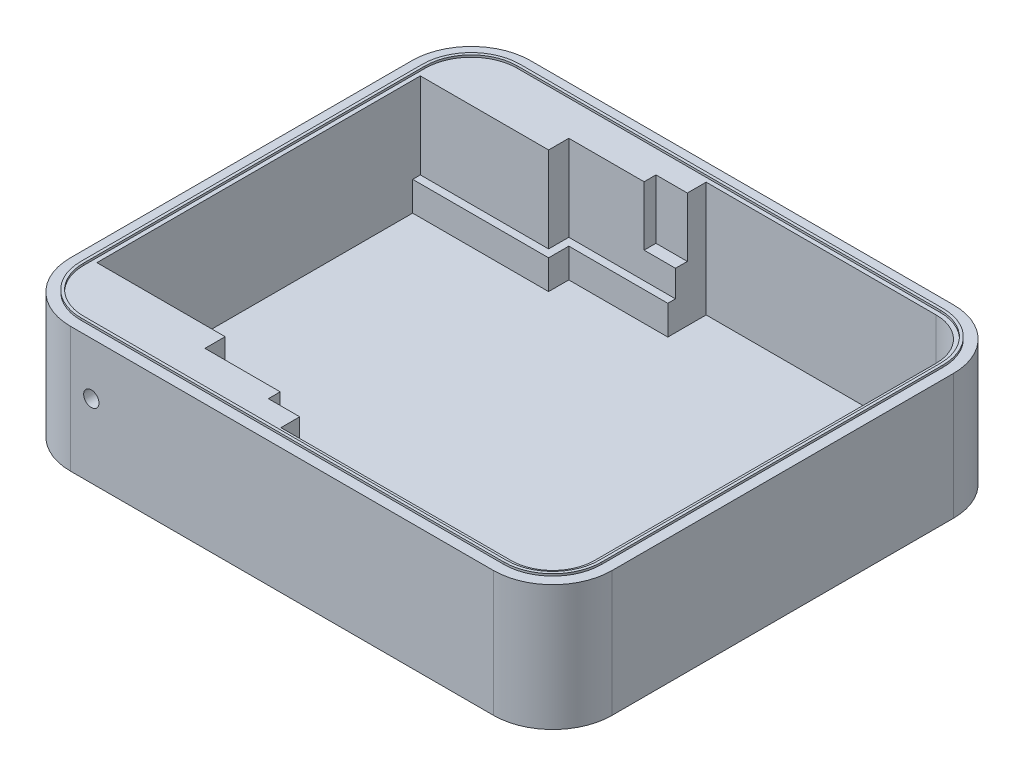
from build123d import *

# Parameters (mm, degrees)
SKETCH1_W            = 72.7
SKETCH1_H            = 61
BOSS_EXTRUDE1_DEPTH  = 1.5
SKETCH3_W            = 76.7
SKETCH3_H            = 65
BOSS_EXTRUDE5_DEPTH  = 1.5
SKETCH2_W            = 76.7
SKETCH2_H            = 65
BOSS_EXTRUDE6_DEPTH  = 4.2
SKETCH4_W            = 76.7
SKETCH4_H            = 65
BOSS_EXTRUDE7_DEPTH  = 3.8
SKETCH5_W            = 76.7
SKETCH5_H            = 65
BOSS_EXTRUDE8_DEPTH  = 8.5
SKETCH7_R            = 1.1
CUT_EXTRUDE1_DEPTH   = 20.8
FILLET3_R            = 8
SKETCH9_W            = 1.2
SKETCH9_H            = 4
CUT_EXTRUDE2_DEPTH   = 8
BOSS_EXTRUDE11_DEPTH = 4.2
FILLET4_R            = 6
FILLET2_R            = 8
BOSS_EXTRUDE12_DEPTH = 18
BOSS_EXTRUDE13_DEPTH = 0.3
SKETCH14_R           = 1.1
CUT_EXTRUDE3_DEPTH   = 14


with BuildPart() as part:
    # Sketch1 → Boss-Extrude1 (new body)
    with BuildSketch(Plane(origin=(0, 0, 0), x_dir=(1, 0, 0), z_dir=(0, 1, 0))):
        Rectangle(SKETCH1_W, SKETCH1_H)
    extrude(amount=BOSS_EXTRUDE1_DEPTH)

    # Sketch3 → Boss-Extrude5 (add)
    with BuildSketch(Plane.XZ):
        Rectangle(SKETCH3_W, SKETCH3_H)
    extrude(amount=-BOSS_EXTRUDE5_DEPTH)

    # Sketch2 → Boss-Extrude6 (add)
    with BuildSketch(Plane(origin=(0, 1.5, 0), x_dir=(1, 0, 0), z_dir=(0, 1, 0))):
        Rectangle(SKETCH2_W, SKETCH2_H)
        Polygon((-2.65, 30.5), (-2.65, 26.1), (-2.65, 22.1), (-3.85, 22.1), (-3.85, 26.1), (-17.95, 26.1), (-17.95, 22.1), (-36.35, 22.1), (-36.35, -22.1), (-17.95, -22.1), (-17.95, -26.1), (-3.85, -26.1), (-3.85, -22.1), (-2.65, -22.1), (-2.65, -26.1), (-2.65, -30.5), (36.35, -30.5), (36.35, 30.5), align=None, mode=Mode.SUBTRACT)
    extrude(amount=BOSS_EXTRUDE6_DEPTH)

    # Sketch4 → Boss-Extrude7 (add)
    with BuildSketch(Plane(origin=(0, 5.7, 0), x_dir=(1, 0, 0), z_dir=(0, 1, 0))):
        Rectangle(SKETCH4_W, SKETCH4_H)
        Polygon((-36.35, -22.1), (-36.35, -23.2), (-17.95, -23.2), (-17.95, -26.1), (-3.85, -26.1), (-3.85, -22.1), (-2.65, -22.1), (-2.65, -30.5), (36.35, -30.5), (36.35, 30.5), (-2.65, 30.5), (-2.65, 22.1), (-3.85, 22.1), (-3.85, 26.1), (-17.95, 26.1), (-17.95, 23.2), (-36.35, 23.2), (-36.35, 22.1), align=None, mode=Mode.SUBTRACT)
    extrude(amount=BOSS_EXTRUDE7_DEPTH)

    # Sketch5 → Boss-Extrude8 (add)
    with BuildSketch(Plane(origin=(0, 9.5, 0), x_dir=(1, 0, 0), z_dir=(0, 1, 0))):
        Rectangle(SKETCH5_W, SKETCH5_H)
        Polygon((-2.65, -27.8), (-3.85, -27.8), (-7.15, -27.8), (-7.15, -26.1), (-17.95, -26.1), (-17.95, -23.2), (-36.35, -23.2), (-36.35, 23.2), (-17.95, 23.2), (-17.95, 26.1), (-7.15, 26.1), (-7.15, 27.8), (-3.85, 27.8), (-2.65, 27.8), (-2.65, 30.5), (36.35, 30.5), (36.35, -30.5), (-2.65, -30.5), align=None, mode=Mode.SUBTRACT)
    extrude(amount=BOSS_EXTRUDE8_DEPTH)

    # Sketch7 → Cut-Extrude1 (cut)
    with BuildSketch(Plane(origin=(0, 0, 23.2), x_dir=(-1, 0, 0), z_dir=(0, 0, -1))):
        with Locations((27.35, 10.5)):
            Circle(SKETCH7_R)
    extrude(amount=-CUT_EXTRUDE1_DEPTH, mode=Mode.SUBTRACT)

    # Fillet3
    fillet3_edges = [part.edges().sort_by_distance(p)[0] for p in [
        (-38.35, 9, -32.5),
        (-38.35, 9, 32.5),
    ]]
    fillet(fillet3_edges, radius=FILLET3_R)

    # Sketch9 → Cut-Extrude2 (cut)
    with BuildSketch(Plane(origin=(0, 9.5, 0), x_dir=(1, 0, 0), z_dir=(0, 1, 0))):
        with Locations((-3.25, 24.1)):
            Rectangle(SKETCH9_W, SKETCH9_H)
        with Locations((-3.25, -24.1)):
            Rectangle(SKETCH9_W, SKETCH9_H)
    extrude(amount=-CUT_EXTRUDE2_DEPTH, mode=Mode.SUBTRACT)

    # Sketch11 → Boss-Extrude11 (add)
    with BuildSketch(Plane(origin=(0, 1.5, 0), x_dir=(1, 0, 0), z_dir=(0, 1, 0))):
        Polygon((-16.85, -22.1), (-17.95, -22.1), (-17.95, -26.1), (-2.65, -26.1), (-2.65, -25), (-16.85, -25), align=None)
        Polygon((-17.95, 26.1), (-17.95, 22.1), (-16.85, 22.1), (-16.85, 25), (-2.65, 25), (-2.65, 26.1), align=None)
    extrude(amount=BOSS_EXTRUDE11_DEPTH)

    # Fillet4
    fillet4_edges = [part.edges().sort_by_distance(p)[0] for p in [
        (36.35, 9.75, -30.5),
        (36.35, 9.75, 30.5),
    ]]
    fillet(fillet4_edges, radius=FILLET4_R)

    # Fillet2
    fillet2_edges = [part.edges().sort_by_distance(p)[0] for p in [
        (38.35, 9, -32.5),
        (38.35, 9, 32.5),
    ]]
    fillet(fillet2_edges, radius=FILLET2_R)

    # Sketch12 → Boss-Extrude12 (add)
    with BuildSketch(Plane(origin=(0, 18, 0), x_dir=(1, 0, 0), z_dir=(0, 1, 0))):
        with BuildLine():
            Line((-30.35, -33), (30.35, -33))
            ThreePointArc((30.35, -33), (36.36040764, -30.51040764), (38.85, -24.5))
            Line((38.85, -24.5), (38.85, 24.5))
            ThreePointArc((38.85, 24.5), (36.36040764, 30.51040764), (30.35, 33))
            Line((30.35, 33), (-30.35, 33))
            ThreePointArc((-30.35, 33), (-36.36040764, 30.51040764), (-38.85, 24.5))
            Line((-38.85, 24.5), (-38.85, -24.5))
            ThreePointArc((-38.85, -24.5), (-36.36040764, -30.51040764), (-30.35, -33))
        make_face()
        with BuildLine():
            Line((38.35, -24.5), (38.35, 24.5))
            ThreePointArc((38.35, 24.5), (36.006854249, 30.156854249), (30.35, 32.5))
            Line((30.35, 32.5), (-30.35, 32.5))
            ThreePointArc((-30.35, 32.5), (-36.006854249, 30.156854249), (-38.35, 24.5))
            Line((-38.35, 24.5), (-38.35, -24.5))
            ThreePointArc((-38.35, -24.5), (-36.006854249, -30.156854249), (-30.35, -32.5))
            Line((-30.35, -32.5), (30.35, -32.5))
            ThreePointArc((30.35, -32.5), (36.006854249, -30.156854249), (38.35, -24.5))
        make_face(mode=Mode.SUBTRACT)
    extrude(amount=-BOSS_EXTRUDE12_DEPTH)

    # Sketch13 → Boss-Extrude13 (add)
    with BuildSketch(Plane(origin=(0, 18, 0), x_dir=(1, 0, 0), z_dir=(0, 1, 0))):
        with BuildLine():
            Line((-30.35, -31.5), (30.35, -31.5))
            ThreePointArc((30.35, -31.5), (35.299747468, -29.449747468), (37.35, -24.5))
            Line((37.35, -24.5), (37.35, 24.5))
            ThreePointArc((37.35, 24.5), (35.299747468, 29.449747468), (30.35, 31.5))
            Line((30.35, 31.5), (-30.35, 31.5))
            ThreePointArc((-30.35, 31.5), (-35.299747468, 29.449747468), (-37.35, 24.5))
            Line((-37.35, 24.5), (-37.35, -24.5))
            ThreePointArc((-37.35, -24.5), (-35.299747468, -29.449747468), (-30.35, -31.5))
        make_face()
        with BuildLine():
            Line((-36.95, 24.5), (-36.95, -24.5))
            ThreePointArc((-36.95, -24.5), (-35.016904756, -29.166904756), (-30.35, -31.1))
            Line((-30.35, -31.1), (30.35, -31.1))
            ThreePointArc((30.35, -31.1), (35.016904756, -29.166904756), (36.95, -24.5))
            Line((36.95, -24.5), (36.95, 24.5))
            ThreePointArc((36.95, 24.5), (35.016904756, 29.166904756), (30.35, 31.1))
            Line((30.35, 31.1), (-30.35, 31.1))
            ThreePointArc((-30.35, 31.1), (-35.016904756, 29.166904756), (-36.95, 24.5))
        make_face(mode=Mode.SUBTRACT)
    extrude(amount=BOSS_EXTRUDE13_DEPTH)

    # Sketch14 → Cut-Extrude3 (cut)
    with BuildSketch(Plane(origin=(0, 0, 23.2), x_dir=(-1, 0, 0), z_dir=(0, 0, -1))):
        with Locations((27.35, 10.5)):
            Circle(SKETCH14_R)
    extrude(amount=-CUT_EXTRUDE3_DEPTH, mode=Mode.SUBTRACT)


solid = part.part
